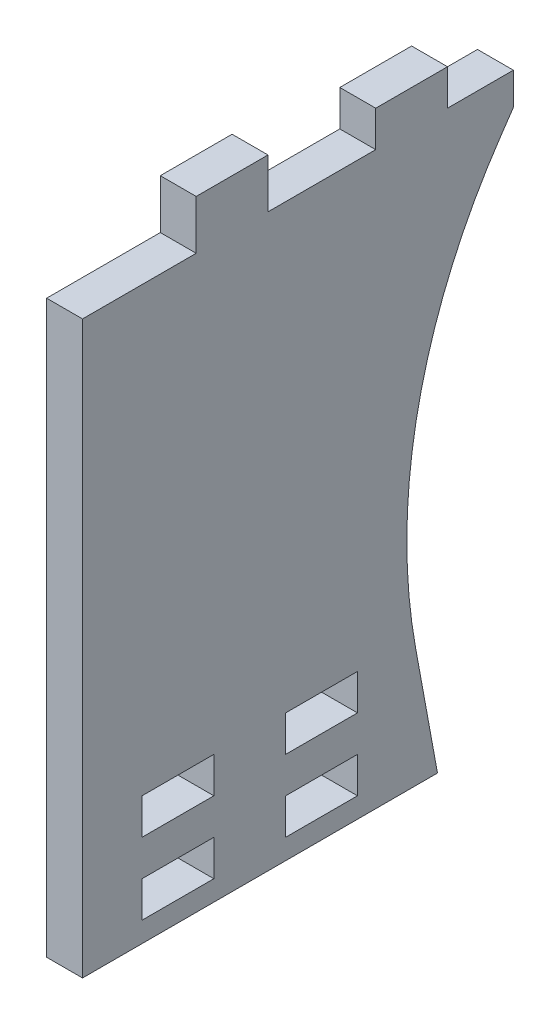
from build123d import *

# Parameters (mm, degrees)
SKETCH1_W           = 12
SKETCH1_H           = 6
BOSS_EXTRUDE1_DEPTH = 6


with BuildPart() as part:
    # Sketch1 → Boss-Extrude1 (new body)
    with BuildSketch(Plane(origin=(0, 0, 0), x_dir=(0, 0, -1), z_dir=(1, 0, 0))):
        with BuildLine():
            Line((-19.809776263, 10.405108849), (-19.809776263, -84.98038082))
            Line((-19.809776263, -84.98038082), (39.507973257, -84.98038082))
            Line((39.507973257, -84.98038082), (35.862319142, -65.117665917))
            ThreePointArc((35.862319142, -65.117665917), (36.331936953, -30.24496444), (50.023720259, 1.830897499))
            Line((50.023720259, 1.830897499), (52.190223737, 5.008360642))
            Line((52.190223737, 5.008360642), (52.190223737, 10.405108849))
            Line((52.190223737, 10.405108849), (41.184188047, 10.405108849))
            Line((41.184188047, 10.405108849), (41.184188047, 16.405108849))
            Line((41.184188047, 16.405108849), (29.184188047, 16.405108849))
            Line((29.184188047, 16.405108849), (29.184188047, 10.405108849))
            Line((29.184188047, 10.405108849), (11.184188047, 10.405108849))
            Line((11.184188047, 10.405108849), (11.184188047, 18.63698455))
            Line((11.184188047, 18.63698455), (-0.815811953, 18.63698455))
            Line((-0.815811953, 18.63698455), (-0.815811953, 10.405108849))
            Line((-0.815811953, 10.405108849), (-19.809776263, 10.405108849))
        make_face()
        with Locations((-3.863115861, -78.586137139)):
            Rectangle(SKETCH1_W, SKETCH1_H, mode=Mode.SUBTRACT)
        with Locations((20.136884139, -78.586137139)):
            Rectangle(SKETCH1_W, SKETCH1_H, mode=Mode.SUBTRACT)
        with Locations((-3.863115861, -66.586137139)):
            Rectangle(SKETCH1_W, SKETCH1_H, mode=Mode.SUBTRACT)
        with Locations((20.136884139, -66.586137139)):
            Rectangle(SKETCH1_W, SKETCH1_H, mode=Mode.SUBTRACT)
    extrude(amount=BOSS_EXTRUDE1_DEPTH)


solid = part.part
